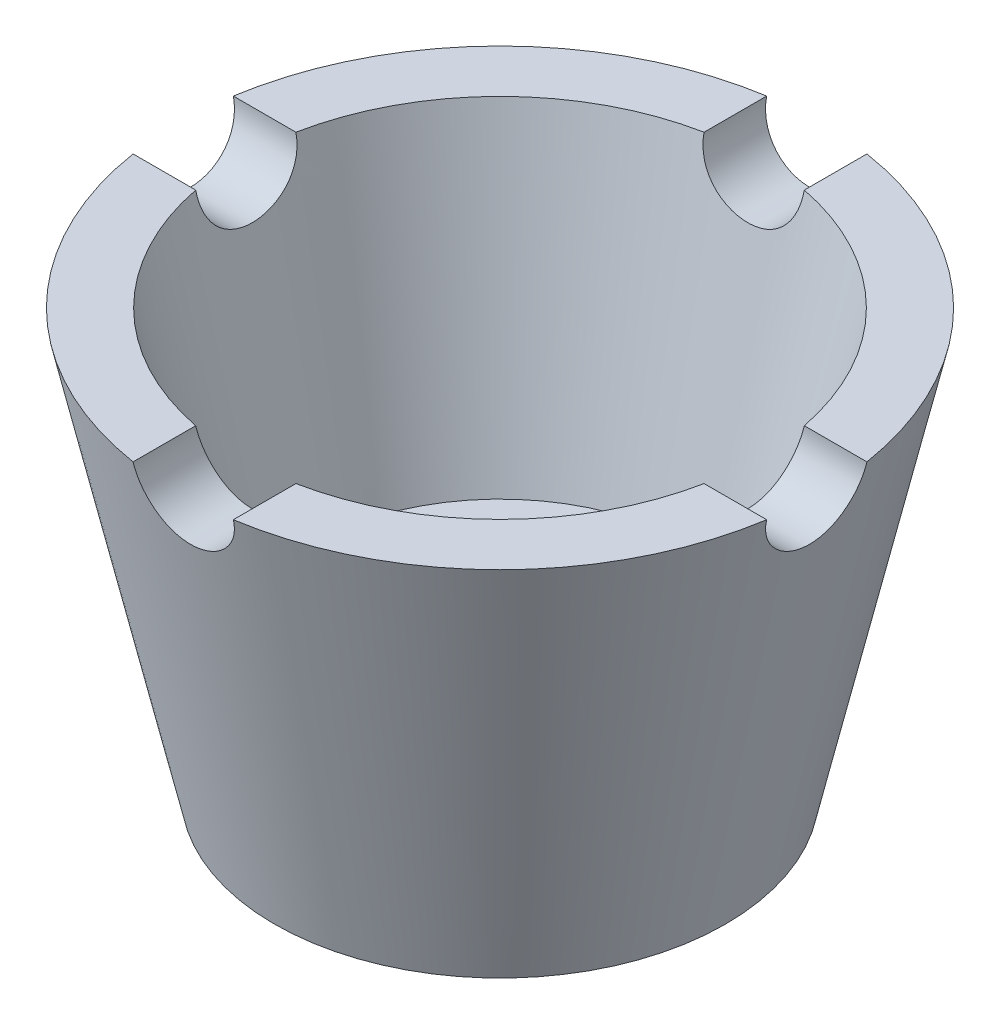
from build123d import *

# Parameters (mm, degrees)
CUT_EXTRUDE1_REACH             = 63.741
CUT_EXTRUDE1_DIRECTION_2_DEPTH = 62.741396162
CIRPATTERN1_COUNT              = 4


with BuildPart() as part:
    # Sketch1 → Revolve1 (revolve)
    with BuildSketch(Plane.XY, mode=Mode.PRIVATE) as revolve1_sk:
        Polygon((11.25, 0), (22.5, 0), (32, 42), (25.848428109, 42), (19.062713823, 12), (11.25, 12), align=None)
    revolve(revolve1_sk.sketch.rotate(Axis((0, 0, 0), (0, 1, 0)), 90), axis=Axis((0, 0, 0), (0, 1, 0)))

    # Sketch2 → Cut-Extrude1 (cut, up to next)
    with BuildSketch(Plane.XY, mode=Mode.PRIVATE) as cut_extrude1_sk1:
        with BuildLine():
            Line((-5, 42), (5, 42))
            ThreePointArc((5, 42), (0, 37), (-5, 42))
        make_face()
    cut_extrude1_tool1 = extrude(cut_extrude1_sk1.sketch, amount=-CUT_EXTRUDE1_REACH, mode=Mode.PRIVATE) & part.part
    cut_extrude1 = cut_extrude1_tool1.solids().sort_by_distance((0, 39.877934, 0))[0]
    add(cut_extrude1, mode=Mode.SUBTRACT)

    # Sketch2 → Cut-Extrude1 direction 2 (cut)
    with BuildSketch(Plane.XY):
        with BuildLine():
            Line((-5, 42), (5, 42))
            ThreePointArc((5, 42), (0, 37), (-5, 42))
        make_face()
    cut_extrude1_direction_2 = extrude(amount=CUT_EXTRUDE1_DIRECTION_2_DEPTH, mode=Mode.SUBTRACT)

    # CirPattern1: Cut-Extrude1, Cut-Extrude1 direction 2 ×4 about axis
    cirpattern1_axis = Axis((0, 42, 0), (0, -1, 0))
    add([cut_extrude1.rotate(cirpattern1_axis, i * 360 / CIRPATTERN1_COUNT) for i in range(1, CIRPATTERN1_COUNT)], mode=Mode.SUBTRACT)
    add([cut_extrude1_direction_2.rotate(cirpattern1_axis, i * 360 / CIRPATTERN1_COUNT) for i in range(1, CIRPATTERN1_COUNT)], mode=Mode.SUBTRACT)


solid = part.part
